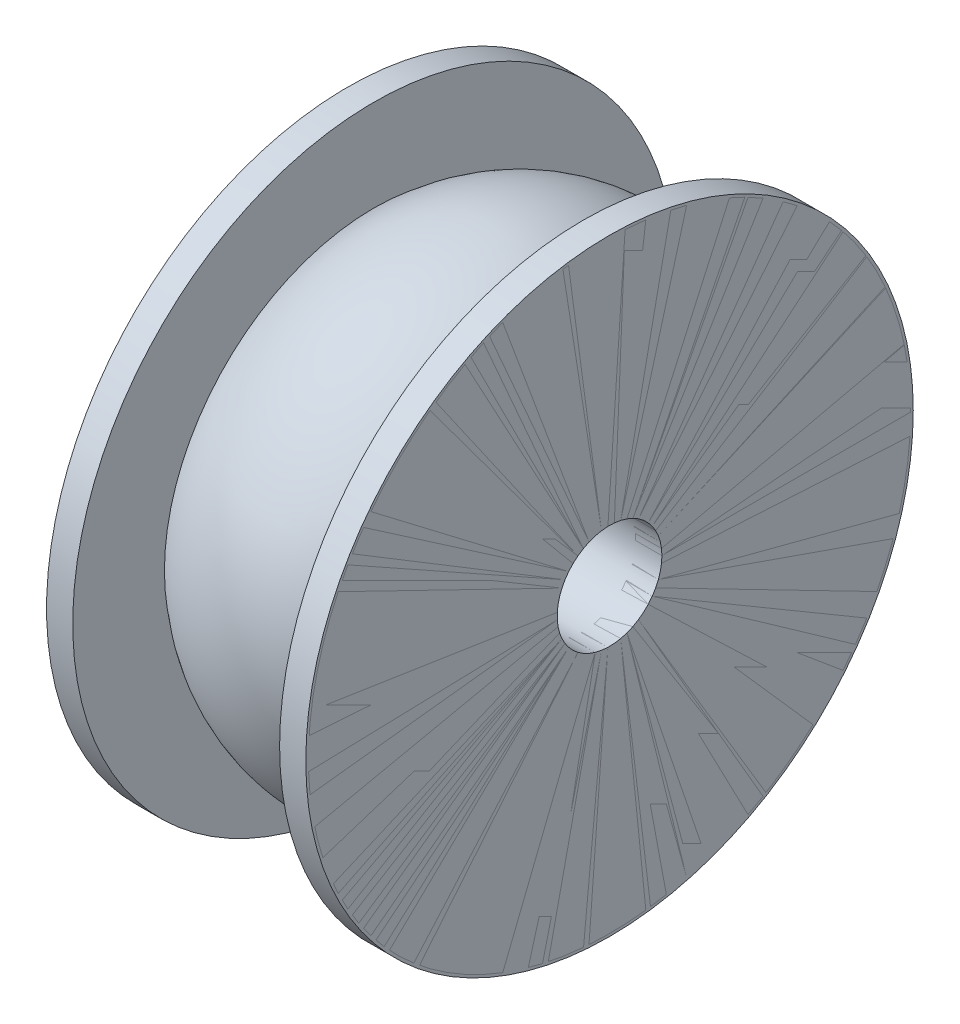
from build123d import *

# Parameters (mm, degrees)
SKETCH6_R           = 5.75
BOSS_EXTRUDE4_DEPTH = 0.5
SKETCH7_W           = 4
SKETCH7_H           = 2.999254163
SKETCH21_R          = 5.8
BOSS_EXTRUDE5_DEPTH = 0.5
SKETCH22_R          = 1
CUT_EXTRUDE1_DEPTH  = 10.606247967


with BuildPart() as part:
    # Sketch6 → Boss-Extrude4 (new body)
    with BuildSketch(Plane(origin=(0, 0, 0), x_dir=(0, 0, -1), z_dir=(1, 0, 0))):
        Circle(SKETCH6_R)
    boss_extrude4 = extrude(amount=-BOSS_EXTRUDE4_DEPTH)

    # Sketch7 → Revolve1 (revolve)
    with BuildSketch(Plane(origin=(0, 0, 0), x_dir=(1, 0, 0), z_dir=(0, 1, 0))):
        with Locations((2, -2.499627081)):
            Rectangle(SKETCH7_W, SKETCH7_H)
        with BuildLine():
            Line((4, -3.999254163), (0, -3.999254163))
            ThreePointArc((0, -3.999254163), (2, -4.763186185), (4, -3.999254163))
        make_face()
    revolve(axis=Axis((0, 0, 0), (1, 0, 0)))

    # Mirror1: Boss-Extrude4 across plane
    add(boss_extrude4.mirror(Plane(origin=(2, 0, 0), x_dir=(0, 0, 1), z_dir=(1, 0, 0))))


with BuildPart() as body_2:
    # Sketch21 → Boss-Extrude5 (new body)
    with BuildSketch(Plane(origin=(4, 0, 0), x_dir=(0, 0, -1), z_dir=(1, 0, 0))):
        Circle(SKETCH21_R)
    extrude(amount=BOSS_EXTRUDE5_DEPTH)


with BuildPart() as cut_extrude1_tool:
    # Sketch22 → Cut-Extrude1 (new, through all)
    with BuildSketch(Plane(origin=(4.5, 0, 0), x_dir=(0, 0, -1), z_dir=(1, 0, 0))):
        Circle(SKETCH22_R)
    extrude(amount=-CUT_EXTRUDE1_DEPTH)


with BuildPart() as part_1:
    add(part.part)

    # Cut-Extrude1: cut by cut_extrude1_tool
    add(cut_extrude1_tool.part, mode=Mode.SUBTRACT)


with BuildPart() as body_2_1:
    add(body_2.part)

    # Cut-Extrude1: cut by cut_extrude1_tool
    add(cut_extrude1_tool.part, mode=Mode.SUBTRACT)


solid = Compound([part_1.part, body_2_1.part])
